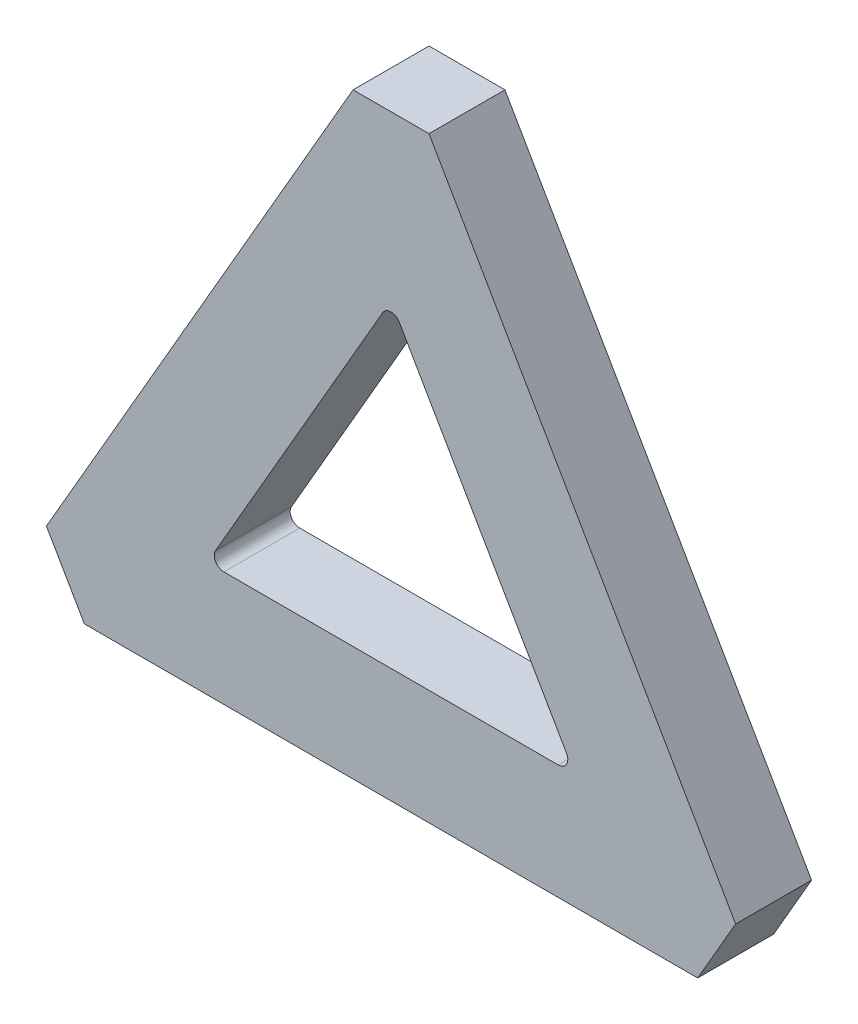
from build123d import *

# Parameters (mm, degrees)
BOSS_EXTRUDE1_DEPTH = 1.984375
CHAMFER2_SIZE       = 1.984375
CHAMFER4_SIZE       = 1.984375
CHAMFER5_SIZE       = 1.984375
FILLET1_R           = 0.25


with BuildPart() as part:
    # Sketch1 → Boss-Extrude1 (new body)
    with BuildSketch(Plane.XY):
        Polygon((0, 0), (-20, 0), (-10, 17.320508076), align=None)
        Polygon((-14.803847577, 3), (-10, 11.320508076), (-5.196152423, 3), align=None, mode=Mode.SUBTRACT)
    extrude(amount=BOSS_EXTRUDE1_DEPTH)

    # Chamfer2
    chamfer2_edges = [part.edges().sort_by_distance(p)[0] for p in [
        (-20, 0, 0.9921875),
    ]]
    chamfer(chamfer2_edges, length=CHAMFER2_SIZE)

    # Chamfer4
    chamfer4_edges = [part.edges().sort_by_distance(p)[0] for p in [
        (0, 0, 0.9921875),
    ]]
    chamfer(chamfer4_edges, length=CHAMFER4_SIZE)

    # Chamfer5
    chamfer5_edges = [part.edges().sort_by_distance(p)[0] for p in [
        (-10, 17.320508076, 0.9921875),
    ]]
    chamfer(chamfer5_edges, length=CHAMFER5_SIZE)

    # Fillet1
    fillet1_edges = [part.edges().sort_by_distance(p)[0] for p in [
        (-14.803847577, 3, 0.9921875),
        (-5.196152423, 3, 0.9921875),
        (-10, 11.320508076, 0.9921875),
    ]]
    fillet(fillet1_edges, radius=FILLET1_R)


solid = part.part
